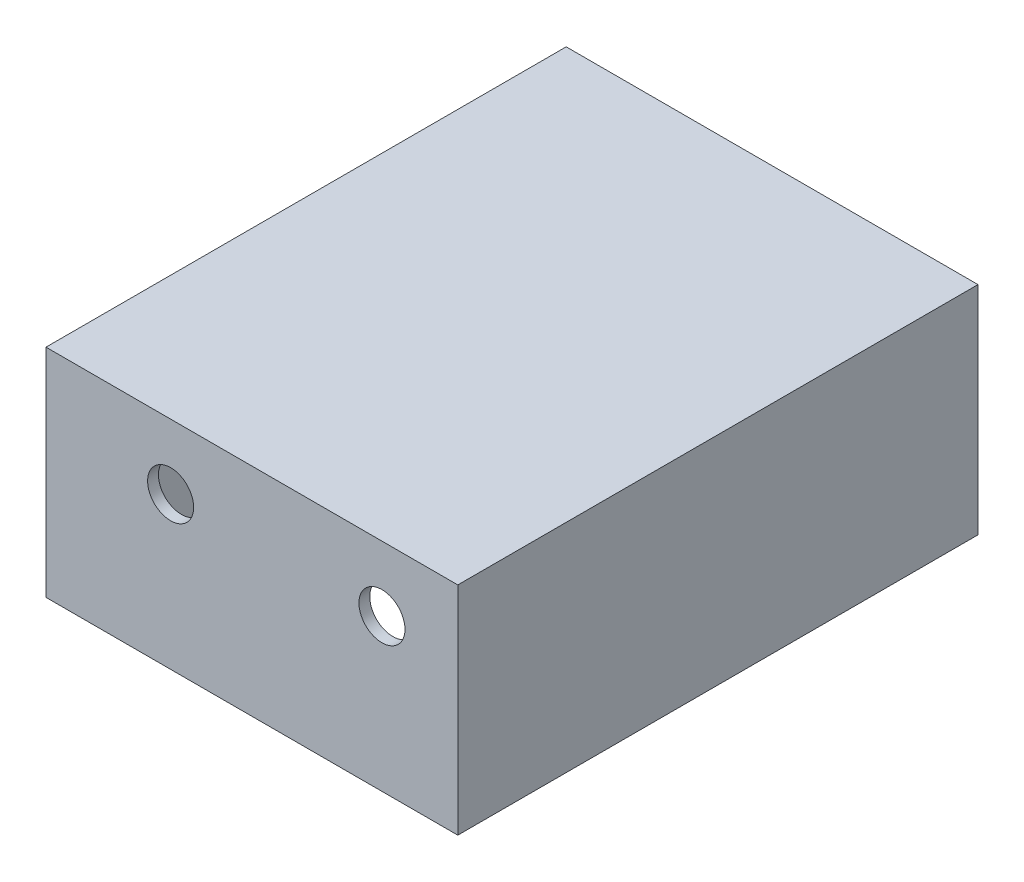
from build123d import *

# Parameters (mm, degrees)
SKETCH1_W               = 76
SKETCH1_H               = 96
BOSS_EXTRUDE1_DEPTH     = 40
SKETCH2_W               = 72
SKETCH2_H               = 92
CUT_EXTRUDE3_DEPTH      = 38
CUT_EXTRUDE4_REACH      = 112.725
SKETCH7_R               = 4.25
SKETCH10_W              = 11
SKETCH10_H              = 5
BOSS_EXTRUDE2_DEPTH     = 15
FILLET2_R               = 3
CUT_EXTRUDE5_REACH      = 110.995
SKETCH11_W              = 6
SKETCH11_H              = 5
SKETCH12_W              = 11
SKETCH12_H              = 5
BOSS_EXTRUDE3_DEPTH     = 2
CUT_EXTRUDE6_REACH      = 100.387
SKETCH13_R              = 3.75
SKETCH15_W              = 10
SKETCH15_H              = 10
SKETCH15_R              = 1.25
BOSS_EXTRUDE4_DEPTH     = 4
MIRROR2_COPY_1_SKETCH_W = 10
MIRROR2_COPY_1_SKETCH_H = 10
MIRROR2_COPY_1_SKETCH_R = 1.25
MIRROR2_COPY_1_DEPTH    = 4
SKETCH17_W              = 6
SKETCH17_H              = 6
CUT_EXTRUDE7_DEPTH      = 2.5
MIRROR4_COPY_1_SKETCH_W = 6
MIRROR4_COPY_1_SKETCH_H = 6
MIRROR4_COPY_1_DEPTH    = 2.5


with BuildPart() as part:
    # Sketch1 → Boss-Extrude1 (new body)
    with BuildSketch(Plane(origin=(0, 0, 0), x_dir=(1, 0, 0), z_dir=(0, 1, 0))):
        Rectangle(SKETCH1_W, SKETCH1_H)
    extrude(amount=BOSS_EXTRUDE1_DEPTH)

    # Sketch2 → Cut-Extrude3 (cut)
    with BuildSketch(Plane.XZ):
        Rectangle(SKETCH2_W, SKETCH2_H)
    extrude(amount=-CUT_EXTRUDE3_DEPTH, mode=Mode.SUBTRACT)

    # Sketch7 → Cut-Extrude4 (cut, up to next)
    with BuildSketch(Plane.XY.offset(48), mode=Mode.PRIVATE) as cut_extrude4_sk1:
        with Locations((-15, 28)):
            Circle(SKETCH7_R)
    cut_extrude4_tool1 = extrude(cut_extrude4_sk1.sketch, amount=-CUT_EXTRUDE4_REACH, mode=Mode.PRIVATE) & part.part
    # Sketch7 → Cut-Extrude4 (cut, up to next)
    with BuildSketch(Plane.XY.offset(48), mode=Mode.PRIVATE) as cut_extrude4_sk2:
        with Locations((24, 28)):
            Circle(SKETCH7_R)
    cut_extrude4_tool2 = extrude(cut_extrude4_sk2.sketch, amount=-CUT_EXTRUDE4_REACH, mode=Mode.PRIVATE) & part.part
    add(cut_extrude4_tool1.solids().sort_by_distance((-15, 28, 48))[0], mode=Mode.SUBTRACT)
    add(cut_extrude4_tool2.solids().sort_by_distance((24, 28, 48))[0], mode=Mode.SUBTRACT)

    # Sketch10 → Boss-Extrude2 (add)
    with BuildSketch(Plane.XZ.offset(-38)):
        with Locations((0, 12.5)):
            Rectangle(SKETCH10_W, SKETCH10_H)
    extrude(amount=BOSS_EXTRUDE2_DEPTH)

    # Fillet2
    fillet2_edges = [part.edges().sort_by_distance(p)[0] for p in [
        (5.5, 30.5, 15),
        (-5.5, 30.5, 15),
    ]]
    fillet(fillet2_edges, radius=FILLET2_R)

    # Sketch11 → Cut-Extrude5 (cut, up to next)
    with BuildSketch(Plane.XY.offset(-46), mode=Mode.PRIVATE) as cut_extrude5_sk1:
        with Locations((22, 16.5)):
            Rectangle(SKETCH11_W, SKETCH11_H)
    cut_extrude5_tool1 = extrude(cut_extrude5_sk1.sketch, amount=-CUT_EXTRUDE5_REACH, mode=Mode.PRIVATE) & part.part
    add(cut_extrude5_tool1.solids().sort_by_distance((22, 16.5, -46))[0], mode=Mode.SUBTRACT)

    # Sketch12 → Boss-Extrude3 (add)
    with BuildSketch(Plane(origin=(0, 0, 10), x_dir=(-1, 0, 0), z_dir=(0, 0, -1))):
        with Locations((0, 25.5)):
            Rectangle(SKETCH12_W, SKETCH12_H)
    extrude(amount=BOSS_EXTRUDE3_DEPTH)

    # Sketch13 → Cut-Extrude6 (cut, up to next)
    with BuildSketch(Plane.ZY.offset(38), mode=Mode.PRIVATE) as cut_extrude6_sk1:
        with Locations((12, 14)):
            Circle(SKETCH13_R)
    cut_extrude6_tool1 = extrude(cut_extrude6_sk1.sketch, amount=-CUT_EXTRUDE6_REACH, mode=Mode.PRIVATE) & part.part
    add(cut_extrude6_tool1.solids().sort_by_distance((-38, 14, 12))[0], mode=Mode.SUBTRACT)

    # Sketch15 → Boss-Extrude4 (add)
    with BuildSketch(Plane.XZ):
        with Locations((31, 41)):
            Rectangle(SKETCH15_W, SKETCH15_H)
        with Locations(Location((31, 41, 0), (0, 0, 270))):
            Circle(SKETCH15_R, mode=Mode.SUBTRACT)
    boss_extrude4 = extrude(amount=-BOSS_EXTRUDE4_DEPTH)

    # Mirror1: Boss-Extrude4 across plane
    add(boss_extrude4.mirror(Plane(origin=(0, 0, 0), x_dir=(0, 0, 1), z_dir=(1, 0, 0))))

    # Mirror2: Boss-Extrude4 across plane
    add(boss_extrude4.mirror(Plane.XY))

    # Mirror2 copy 1 sketch → Mirror2 copy 1 (add)
    with BuildSketch(Plane(origin=(0, 0, 0), x_dir=(-1, 0, 0), z_dir=(0, -1, 0))):
        with Locations((31, 41)):
            Rectangle(MIRROR2_COPY_1_SKETCH_W, MIRROR2_COPY_1_SKETCH_H)
        with Locations(Location((31, 41, 0), (0, 0, 270))):
            Circle(MIRROR2_COPY_1_SKETCH_R, mode=Mode.SUBTRACT)
    extrude(amount=-MIRROR2_COPY_1_DEPTH)

    # Sketch17 → Cut-Extrude7 (cut)
    with BuildSketch(Plane(origin=(0, 4, 0), x_dir=(1, 0, 0), z_dir=(0, 1, 0))):
        with Locations((31, -41)):
            Rectangle(SKETCH17_W, SKETCH17_H)
    cut_extrude7 = extrude(amount=-CUT_EXTRUDE7_DEPTH, mode=Mode.SUBTRACT)

    # Mirror3: Cut-Extrude7 across plane
    add(cut_extrude7.mirror(Plane(origin=(0, 0, 0), x_dir=(0, 0, 1), z_dir=(1, 0, 0))), mode=Mode.SUBTRACT)

    # Mirror4: Cut-Extrude7 across plane
    add(cut_extrude7.mirror(Plane.XY), mode=Mode.SUBTRACT)

    # Mirror4 copy 1 sketch → Mirror4 copy 1 (cut)
    with BuildSketch(Plane(origin=(0, 4, 0), x_dir=(-1, 0, 0), z_dir=(0, 1, 0))):
        with Locations((31, -41)):
            Rectangle(MIRROR4_COPY_1_SKETCH_W, MIRROR4_COPY_1_SKETCH_H)
    extrude(amount=-MIRROR4_COPY_1_DEPTH, mode=Mode.SUBTRACT)


solid = part.part
